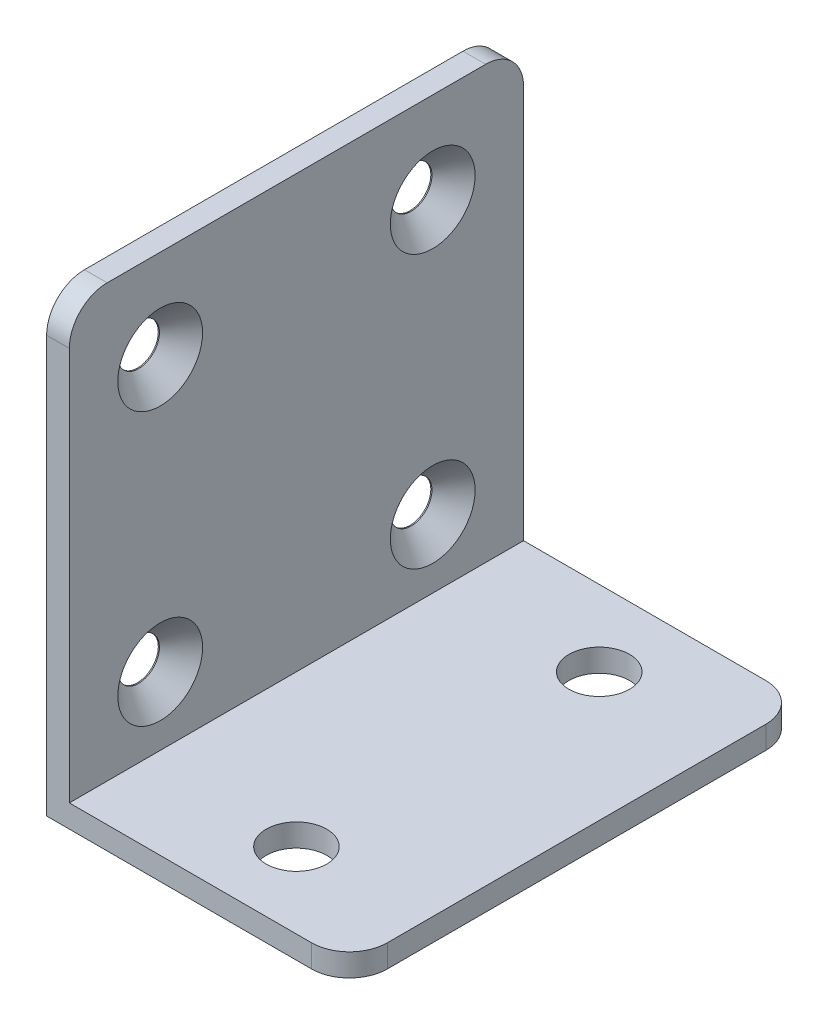
from build123d import *

# Parameters (mm, degrees)
DODANIE_WYCI_GNI_CIE1_DEPTH                        = 30
DODANIE_WYCI_GNI_CIE1_DEPTH_BACK                   = 30
SZKIC1_W                                           = 40
SZKIC1_H                                           = 60
SZKIC2_W                                           = 37
SZKIC2_H                                           = 57
WYTNIJ_WYCI_GNI_CIE1_DEPTH                         = 71
SZKIC3_R                                           = 4
WYTNIJ_WYCI_GNI_CIE2_DEPTH                         = 40
POG_BIENIE_STO_KOWE_POD_M5_WKR_T_Z_BEM_D           = 5.5
POG_BIENIE_STO_KOWE_POD_M5_WKR_T_Z_BEM_DEPTH       = 10
POG_BIENIE_STO_KOWE_POD_M5_WKR_T_Z_BEM_CSINK_D     = 11.2
POG_BIENIE_STO_KOWE_POD_M5_WKR_T_Z_BEM_CSINK_ANGLE = 90
POG_BIENIE_STO_KOWE_POD_M5_WKR_T_Z_BEM_TIP         = 1.652366702
ZAOKR_GLENIE1_R                                    = 5


with BuildPart() as part:
    # Szkic1 → Dodanie-wyciągnięcie1 (new, two sides: drawn at the far end of the back side and taken through both)
    with BuildSketch(Plane.XY.offset(-DODANIE_WYCI_GNI_CIE1_DEPTH_BACK)):
        Rectangle(SZKIC1_W, SZKIC1_H)
    extrude(amount=DODANIE_WYCI_GNI_CIE1_DEPTH + DODANIE_WYCI_GNI_CIE1_DEPTH_BACK)

    # Szkic2 → Wytnij-wyciągnięcie1 (cut, through all)
    with BuildSketch(Plane.XY.offset(30)):
        with Locations((1.5, 1.5)):
            Rectangle(SZKIC2_W, SZKIC2_H)
    extrude(amount=-WYTNIJ_WYCI_GNI_CIE1_DEPTH, mode=Mode.SUBTRACT)

    # Szkic3 → Wytnij-wyciągnięcie2 (cut)
    with BuildSketch(Plane(origin=(0, -30, 0), x_dir=(-1, 0, 0), z_dir=(0, -1, 0))):
        with Locations((-3, -20)):
            Circle(SZKIC3_R)
        with Locations((-3, 20)):
            Circle(SZKIC3_R)
    extrude(amount=-WYTNIJ_WYCI_GNI_CIE2_DEPTH, mode=Mode.SUBTRACT)

    # Pogłębienie stożkowe pod M5 Wkręt z łbem stożkowym płaskim1
    with Locations(Plane(origin=(-17, 0, 0), x_dir=(0, 0, -1), z_dir=(1, 0, 0))):
        with Locations((-18, 18), (18, 18), (18, -18), (-18, -18)):
            CounterSinkHole(POG_BIENIE_STO_KOWE_POD_M5_WKR_T_Z_BEM_D / 2, POG_BIENIE_STO_KOWE_POD_M5_WKR_T_Z_BEM_CSINK_D / 2, depth=POG_BIENIE_STO_KOWE_POD_M5_WKR_T_Z_BEM_DEPTH, counter_sink_angle=POG_BIENIE_STO_KOWE_POD_M5_WKR_T_Z_BEM_CSINK_ANGLE)
            with Locations((0, 0, -(POG_BIENIE_STO_KOWE_POD_M5_WKR_T_Z_BEM_DEPTH + POG_BIENIE_STO_KOWE_POD_M5_WKR_T_Z_BEM_TIP / 2))):  # 118° drill point
                Cone(0, POG_BIENIE_STO_KOWE_POD_M5_WKR_T_Z_BEM_D / 2, POG_BIENIE_STO_KOWE_POD_M5_WKR_T_Z_BEM_TIP, mode=Mode.SUBTRACT)

    # Zaokrąglenie1
    zaokr_glenie1_edges = [part.edges().sort_by_distance(p)[0] for p in [
        (-18.5, 30, -30),
        (-18.5, 30, 30),
        (20, -28.5, -30),
        (20, -28.5, 30),
    ]]
    fillet(zaokr_glenie1_edges, radius=ZAOKR_GLENIE1_R)


solid = part.part
